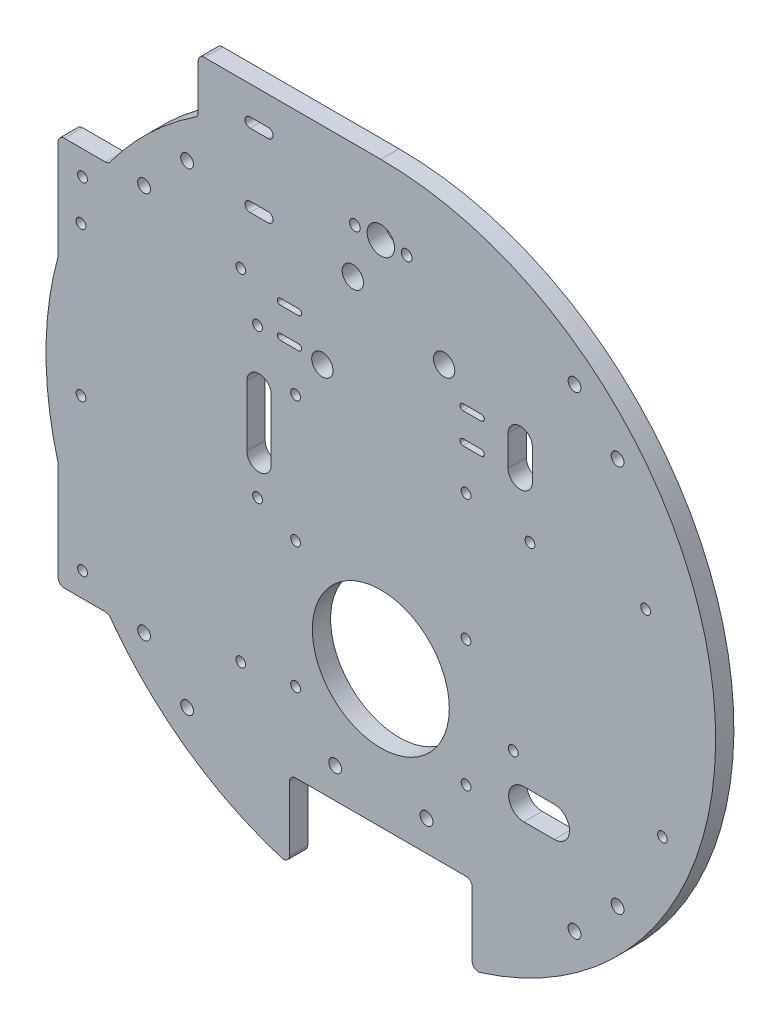
from build123d import *

# Parameters (mm, degrees)
BOSS_EXTRU_1_DEPTH                       = 6
ESQUISSE2_R                              = 1.6
ESQUISSE2_R_2                            = 1.75
ESQUISSE2_R_3                            = 4.5
ENL_V_MAT_EXTRU_1_DEPTH                  = 10
ESQUISSE4_R                              = 22.5
ENL_V_MAT_EXTRU_2_DEPTH                  = 220.626956451
ESQUISSE5_R                              = 2.1
ENL_V_MAT_EXTRU_4_DEPTH                  = 220.626956451
CONG_2_R                                 = 2
ENL_V_MAT_EXTRU_5_REACH                  = 221.627
ESQUISSE7_R                              = 2.1
ENL_V_MAT_EXTRU_6_DEPTH                  = 220.626956451
R_P_TITION_CIRCULAIRE1_COUNT             = 4
ESQUISSE8_R                              = 3.5
ENL_V_MAT_EXTRU_RELAIS_MOT_PISTON_DEPTH  = 220.626956451
ENL_V_MAT_EXTRU_8_DEPTH                  = 220.626956451
BOSS_EXTRU_2_DEPTH                       = 6
ENL_V_MAT_EXTRU_9_DEPTH                  = 220.626956451
CONG_3_R                                 = 2
ESQUISSE10_R                             = 1.6
ENL_V_MAT_EXTRU_PONT_H_MOT_CAISSES_DEPTH = 220.626956451
CONG_3_OF_SYM_TRIE2_R                    = 2
ENL_V_MAT_EXTRU_7_DEPTH                  = 220.626956451
ESQUISSE11_R                             = 1.6
ENL_V_MAT_EXTRU_RASPBERRY_DEPTH          = 220.626956451
ESQUISSE12_R                             = 1.6
ENL_V_MAT_EXTRU_ARDUINO_DEPTH            = 220.626956451


with BuildPart() as part:
    # Esquisse1 → Boss.-Extru.1 (new body)
    with BuildSketch(Plane.XY):
        with BuildLine():
            Line((-30, 0), (-30, -25.830052443))
            ThreePointArc((-30, -25.830052443), (-108.759019704, 63.523482378), (-60, 172.195444573))
            Line((-60, 172.195444573), (-60, 190))
            Line((-60, 190), (0, 190))
            ThreePointArc((0, 190), (108.952525828, 95.144210632), (30, -25.830052443))
            Line((30, -25.830052443), (30, 0))
            Line((30, 0), (-30, 0))
        make_face()
    extrude(amount=BOSS_EXTRU_1_DEPTH)

    # Esquisse2 → Enlèv. mat.-Extru.1 (cut)
    with BuildSketch(Plane.XY):
        with Locations((28, 26)):
            Circle(ESQUISSE2_R)
        with Locations((-28, 26)):
            Circle(ESQUISSE2_R)
        with Locations((-28, 67.5)):
            Circle(ESQUISSE2_R)
        with Locations((-28, 109)):
            Circle(ESQUISSE2_R)
        with Locations((28, 67.5)):
            Circle(ESQUISSE2_R)
        with Locations((28, 109)):
            Circle(ESQUISSE2_R)
        with Locations((8.5, 167)):
            Circle(ESQUISSE2_R_2)
        with Locations((-8.5, 167)):
            Circle(ESQUISSE2_R_2)
        with Locations((0, 167)):
            Circle(ESQUISSE2_R_3)
    extrude(amount=ENL_V_MAT_EXTRU_1_DEPTH, mode=Mode.SUBTRACT)

    # Esquisse4 → Enlèv. mat.-Extru.2 (cut, through all)
    with BuildSketch(Plane.XY):
        with Locations((0, 45)):
            Circle(ESQUISSE4_R)
    extrude(amount=ENL_V_MAT_EXTRU_2_DEPTH, mode=Mode.SUBTRACT)

    # Esquisse5 → Enlèv. mat.-Extru.4 (cut, through all)
    with BuildSketch(Plane(origin=(0, 0, 0), x_dir=(-1, 0, 0), z_dir=(0, 0, -1))):
        with Locations((15, 10)):
            Circle(ESQUISSE5_R)
    enl_v_mat_extru_4 = extrude(amount=-ENL_V_MAT_EXTRU_4_DEPTH, mode=Mode.SUBTRACT)

    # Symétrie1: Enlèv. mat.-Extru.4 across plane
    add(enl_v_mat_extru_4.mirror(Plane(origin=(0, 0, 0), x_dir=(0, 0, 1), z_dir=(1, 0, 0))), mode=Mode.SUBTRACT)

    # Congé2
    cong_2_edges = [part.edges().sort_by_distance(p)[0] for p in [
        (-30, -25.830052443, 3),
        (-30, 0, 3),
        (30, 0, 3),
        (30, -25.830052443, 3),
        (-60, 172.195444573, 3),
        (-60, 190, 3),
    ]]
    fillet(cong_2_edges, radius=CONG_2_R)

    # Esquisse6 → Enlèv. mat.-Extru.5 (cut, up to next)
    with BuildSketch(Plane.XY.offset(6), mode=Mode.PRIVATE) as enl_v_mat_extru_5_sk1:
        with BuildLine():
            Line((-43, 180.6), (-37, 180.6))
            ThreePointArc((-37, 180.6), (-35.4, 179), (-37, 177.4))
            Line((-37, 177.4), (-43, 177.4))
            ThreePointArc((-43, 177.4), (-44.6, 179), (-43, 180.6))
        make_face()
    enl_v_mat_extru_5_tool1 = extrude(enl_v_mat_extru_5_sk1.sketch, amount=-ENL_V_MAT_EXTRU_5_REACH, mode=Mode.PRIVATE) & part.part
    # Esquisse6 → Enlèv. mat.-Extru.5 (cut, up to next)
    with BuildSketch(Plane.XY.offset(6), mode=Mode.PRIVATE) as enl_v_mat_extru_5_sk2:
        with BuildLine():
            Line((-43, 156.6), (-37, 156.6))
            ThreePointArc((-37, 156.6), (-35.4, 155), (-37, 153.4))
            Line((-37, 153.4), (-43, 153.4))
            ThreePointArc((-43, 153.4), (-44.6, 155), (-43, 156.6))
        make_face()
    enl_v_mat_extru_5_tool2 = extrude(enl_v_mat_extru_5_sk2.sketch, amount=-ENL_V_MAT_EXTRU_5_REACH, mode=Mode.PRIVATE) & part.part
    add(enl_v_mat_extru_5_tool1.solids().sort_by_distance((-40, 179, 6))[0], mode=Mode.SUBTRACT)
    add(enl_v_mat_extru_5_tool2.solids().sort_by_distance((-40, 155, 6))[0], mode=Mode.SUBTRACT)

    # Esquisse7 → Enlèv. mat.-Extru.6 (cut, through all)
    with BuildSketch(Plane(origin=(0, 0, 0), x_dir=(-1, 0, 0), z_dir=(0, 0, -1))):
        with Locations((-63.639610307, 157.781745931)):
            Circle(ESQUISSE7_R)
        with Locations((-77.781745931, 143.639610307)):
            Circle(ESQUISSE7_R)
    enl_v_mat_extru_6 = extrude(amount=-ENL_V_MAT_EXTRU_6_DEPTH, mode=Mode.SUBTRACT)

    # Répétition circulaire1: Enlèv. mat.-Extru.6 ×4 about axis
    r_p_tition_circulaire1_axis = Axis((0, 80, 6), (0, 0, -1))
    for i in range(1, R_P_TITION_CIRCULAIRE1_COUNT):
        add(enl_v_mat_extru_6.rotate(r_p_tition_circulaire1_axis, i * 360 / R_P_TITION_CIRCULAIRE1_COUNT), mode=Mode.SUBTRACT)

    # Esquisse8 → Enlèv. mat.-Extru. Relais Mot piston (cut, through all)
    with BuildSketch(Plane.XY.offset(6)):
        with Locations((20.8, 142)):
            Circle(ESQUISSE8_R)
        with Locations((-9.2, 152)):
            Circle(ESQUISSE8_R)
        with Locations((-19.2, 122)):
            Circle(ESQUISSE8_R)
    extrude(amount=-ENL_V_MAT_EXTRU_RELAIS_MOT_PISTON_DEPTH, mode=Mode.SUBTRACT)

    # Esquisse14 → Enlèv. mat.-Extru.8 (cut, through all)
    with BuildSketch(Plane.XY):
        with BuildLine():
            Line((-33, 134), (-27, 134))
            ThreePointArc((-27, 134), (-26, 133), (-27, 132))
            Line((-27, 132), (-33, 132))
            ThreePointArc((-33, 132), (-34, 133), (-33, 134))
        make_face()
        with BuildLine():
            Line((-33, 124), (-27, 124))
            ThreePointArc((-27, 124), (-26, 123), (-27, 122))
            Line((-27, 122), (-33, 122))
            ThreePointArc((-33, 122), (-34, 123), (-33, 124))
        make_face()
    enl_v_mat_extru_8 = extrude(amount=ENL_V_MAT_EXTRU_8_DEPTH, mode=Mode.SUBTRACT)

    # Symétrie3: Enlèv. mat.-Extru.8 across plane
    add(enl_v_mat_extru_8.mirror(Plane(origin=(0, 0, 0), x_dir=(0, 0, 1), z_dir=(1, 0, 0))), mode=Mode.SUBTRACT)

    # Esquisse9 → Boss.-Extru.2 (add)
    with BuildSketch(Plane.XY):
        with BuildLine():
            Line((-106, 144), (-106, 109.393876913))
            ThreePointArc((-106, 109.393876913), (-99.252430796, 127.423148156), (-89.465076985, 144))
            Line((-89.465076985, 144), (-106, 144))
        make_face()
    boss_extru_2 = extrude(amount=BOSS_EXTRU_2_DEPTH)

    # Esquisse15 → Enlèv. mat.-Extru.9 (cut, through all)
    with BuildSketch(Plane.XY.offset(6)):
        with BuildLine():
            Line((49.8, 133), (49.8, 123))
            ThreePointArc((49.8, 123), (45.8, 119), (41.8, 123))
            Line((41.8, 123), (41.8, 133))
            ThreePointArc((41.8, 133), (45.8, 137), (49.8, 133))
        make_face()
    extrude(amount=-ENL_V_MAT_EXTRU_9_DEPTH, mode=Mode.SUBTRACT)

    # Congé3
    cong_3_edges = [part.edges().sort_by_distance(p)[0] for p in [
        (-106, 144, 3),
        (-106, 109.393876913, 3),
        (-89.465076985, 144, 3),
    ]]
    fillet(cong_3_edges, radius=CONG_3_R)

    # Esquisse10 → Enlèv. mat.-Extru. Pont H Mot caisses (cut, through all)
    with BuildSketch(Plane.XY):
        with Locations((-46, 136)):
            Circle(ESQUISSE10_R)
        with Locations((-98, 136)):
            Circle(ESQUISSE10_R)
    enl_v_mat_extru_pont_h_mot_caisses = extrude(amount=ENL_V_MAT_EXTRU_PONT_H_MOT_CAISSES_DEPTH, mode=Mode.SUBTRACT)

    # Symétrie2: Boss.-Extru.2, Enlèv. mat.-Extru. Pont H Mot caisses across plane
    add(boss_extru_2.mirror(Plane.ZX.offset(80)))
    add(enl_v_mat_extru_pont_h_mot_caisses.mirror(Plane.ZX.offset(80)), mode=Mode.SUBTRACT)

    # Congé3 of Symétrie2
    cong_3_of_sym_trie2_edges = [part.edges().sort_by_distance(p)[0] for p in [
        (-106, 16, 3),
        (-106, 50.606123087, 3),
        (-89.465076985, 16, 3),
    ]]
    fillet(cong_3_of_sym_trie2_edges, radius=CONG_3_OF_SYM_TRIE2_R)

    # Esquisse13 → Enlèv. mat.-Extru.7 (cut, through all)
    with BuildSketch(Plane.XY.offset(6)):
        with BuildLine():
            Line((-44, 85), (-44, 105))
            ThreePointArc((-44, 105), (-40, 109), (-36, 105))
            Line((-36, 105), (-36, 85))
            ThreePointArc((-36, 85), (-40, 81), (-44, 85))
        make_face()
    extrude(amount=-ENL_V_MAT_EXTRU_7_DEPTH, mode=Mode.SUBTRACT)

    # Esquisse11 → Enlèv. mat.-Extru. Raspberry (cut, through all)
    with BuildSketch(Plane.XY.offset(6)):
        with Locations((-40.5, 73.5)):
            Circle(ESQUISSE11_R)
        with Locations((-98.5, 73.5)):
            Circle(ESQUISSE11_R)
        with Locations((-40.5, 122.5)):
            Circle(ESQUISSE11_R)
        with Locations((-98.5, 122.5)):
            Circle(ESQUISSE11_R)
    extrude(amount=-ENL_V_MAT_EXTRU_RASPBERRY_DEPTH, mode=Mode.SUBTRACT)

    # Esquisse12 → Enlèv. mat.-Extru. Arduino (cut, through all)
    with BuildSketch(Plane.XY.offset(6)):
        with Locations((43.5, 43.5)):
            Circle(ESQUISSE12_R)
        with Locations((92.5, 43.5)):
            Circle(ESQUISSE12_R)
        with Locations((49, 105.5)):
            Circle(ESQUISSE12_R)
        with Locations((87, 105.5)):
            Circle(ESQUISSE12_R)
        with BuildLine():
            Line((47, 35), (57, 35))
            ThreePointArc((57, 35), (62, 30), (57, 25))
            Line((57, 25), (47, 25))
            ThreePointArc((47, 25), (42, 30), (47, 35))
        make_face()
    extrude(amount=-ENL_V_MAT_EXTRU_ARDUINO_DEPTH, mode=Mode.SUBTRACT)


solid = part.part
